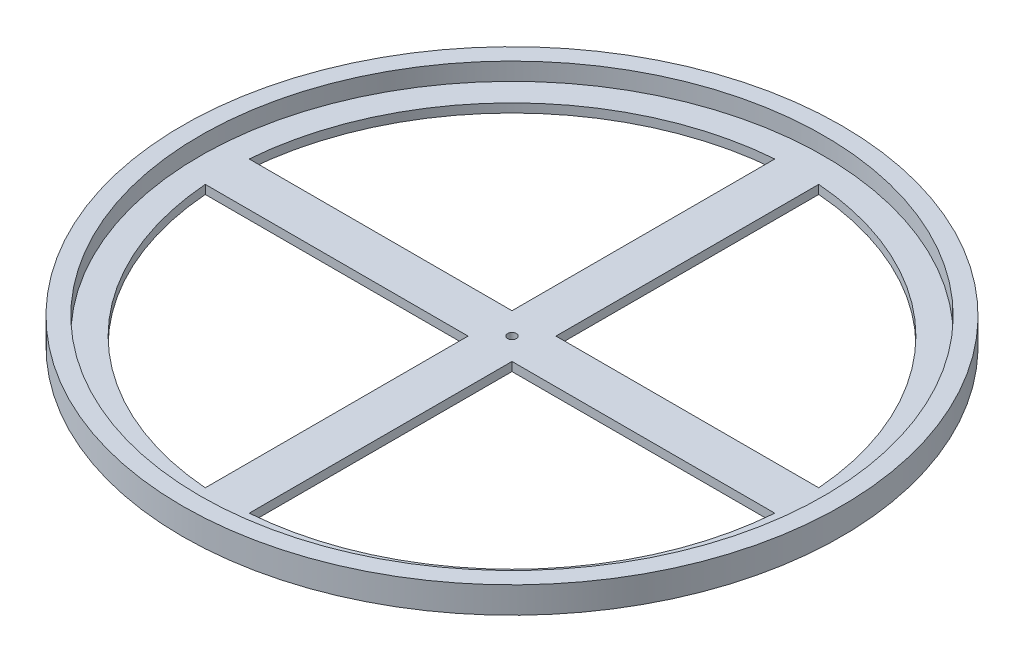
from build123d import *

# Parameters (mm, degrees)
SKETCH1_R           = 37.5
SKETCH1_R_2         = 32.5
SKETCH1_W           = 5
SKETCH1_H           = 5
SKETCH1_R_3         = 0.5
BOSS_EXTRUDE1_DEPTH = 1
SKETCH2_R           = 37.5
SKETCH2_R_2         = 35.5
BOSS_EXTRUDE2_DEPTH = 2


with BuildPart() as part:
    # Sketch1 → Boss-Extrude1 (new body)
    # profile 1 of 6: a face of its own
    with BuildSketch(Plane(origin=(0, 0, 0), x_dir=(1, 0, 0), z_dir=(0, 1, 0))):
        with Locations(Location((0, 0, 0), (0, 0, 270))):
            Circle(SKETCH1_R)
        Circle(SKETCH1_R_2, mode=Mode.SUBTRACT)
    # profile 2 of 6: a face of its own
    with BuildSketch(Plane(origin=(0, 0, 0), x_dir=(1, 0, 0), z_dir=(0, 1, 0))):
        with BuildLine():
            ThreePointArc((2.5, 32.403703492), (0, 32.5), (-2.5, 32.403703492))
            Line((-2.5, 32.403703492), (-2.5, 2.5))
            Line((-2.5, 2.5), (2.5, 2.5))
            Line((2.5, 2.5), (2.5, 32.403703492))
        make_face()
    # profile 3 of 6: a face of its own
    with BuildSketch(Plane(origin=(0, 0, 0), x_dir=(1, 0, 0), z_dir=(0, 1, 0))):
        with BuildLine():
            Line((2.5, -2.5), (-2.5, -2.5))
            Line((-2.5, -2.5), (-2.5, -32.403703492))
            ThreePointArc((-2.5, -32.403703492), (0, -32.5), (2.5, -32.403703492))
            Line((2.5, -32.403703492), (2.5, -2.5))
        make_face()
    # profile 4 of 6: a face of its own
    with BuildSketch(Plane(origin=(0, 0, 0), x_dir=(1, 0, 0), z_dir=(0, 1, 0))):
        with BuildLine():
            Line((-2.5, -2.5), (-2.5, 2.5))
            Line((-2.5, 2.5), (-32.403703492, 2.5))
            ThreePointArc((-32.403703492, 2.5), (-32.5, 0), (-32.403703492, -2.5))
            Line((-32.403703492, -2.5), (-2.5, -2.5))
        make_face()
    # profile 5 of 6: a face of its own
    with BuildSketch(Plane(origin=(0, 0, 0), x_dir=(1, 0, 0), z_dir=(0, 1, 0))):
        with BuildLine():
            Line((32.403703492, 2.5), (2.5, 2.5))
            Line((2.5, 2.5), (2.5, -2.5))
            Line((2.5, -2.5), (32.403703492, -2.5))
            ThreePointArc((32.403703492, -2.5), (32.47591695, -1.250926958), (32.5, 0))
            ThreePointArc((32.5, 0), (32.47591695, 1.250926958), (32.403703492, 2.5))
        make_face()
    # profile 6 of 6: a face of its own
    with BuildSketch(Plane(origin=(0, 0, 0), x_dir=(1, 0, 0), z_dir=(0, 1, 0))):
        Rectangle(SKETCH1_W, SKETCH1_H)
        with Locations(Location((0, 0, 0), (0, 0, 270))):
            Circle(SKETCH1_R_3, mode=Mode.SUBTRACT)
    extrude(amount=BOSS_EXTRUDE1_DEPTH)

    # Sketch2 → Boss-Extrude2 (add)
    with BuildSketch(Plane(origin=(0, 1, 0), x_dir=(1, 0, 0), z_dir=(0, 1, 0))):
        with Locations(Location((0, 0, 0), (0, 0, 270))):
            Circle(SKETCH2_R)
        with Locations(Location((0, 0, 0), (0, 0, 270))):
            Circle(SKETCH2_R_2, mode=Mode.SUBTRACT)
    extrude(amount=BOSS_EXTRUDE2_DEPTH)


solid = part.part
